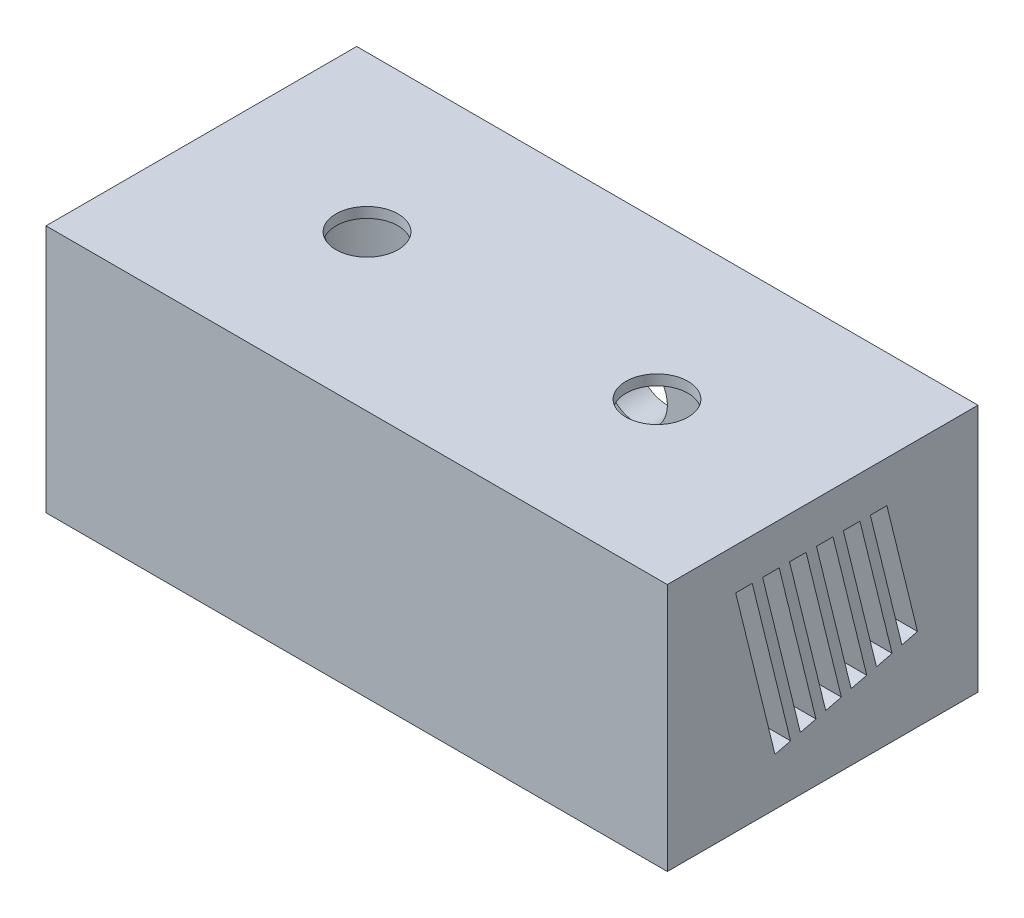
from build123d import *

# Parameters (mm, degrees)
SKETCH2_W                                     = 300
SKETCH2_H                                     = 150
BOSS_EXTRUDE1_DEPTH                           = 120
CUT_EXTRUDE2_DEPTH                            = 5
CUT_EXTRUDE3_DEPTH                            = 110
CBORE_FOR_M4_PAN_HEAD_MACHINE_SCREW1_AT_COUNT = 2
CBORE_FOR_M4_PAN_HEAD_MACHINE_SCREW1_AT_PITCH = 256
CBORE_FOR_M4_PAN_HEAD_MACHINE_SCREW1_2_COUNT  = 2
CBORE_FOR_M4_PAN_HEAD_MACHINE_SCREW1_2_PITCH  = 277.077606457
CBORE_FOR_M4_PAN_HEAD_MACHINE_SCREW1_3_COUNT  = 2
CBORE_FOR_M4_PAN_HEAD_MACHINE_SCREW1_3_PITCH  = 106
CUT_EXTRUDE5_DEPTH                            = 332.700165812
SKETCH17_R                                    = 15
CUT_EXTRUDE6_DEPTH                            = 20
SKETCH3_R                                     = 15
CUT_EXTRUDE1_DEPTH                            = 50


with BuildPart() as part:
    # Sketch2 → Boss-Extrude1 (new body)
    with BuildSketch(Plane(origin=(0, 0, 0), x_dir=(1, 0, 0), z_dir=(0, 1, 0))):
        Rectangle(SKETCH2_W, SKETCH2_H)
    extrude(amount=BOSS_EXTRUDE1_DEPTH)

    # Sketch7 → Cut-Extrude2 (cut)
    with BuildSketch(Plane.XZ):
        with BuildLine():
            Line((-120, 65), (120, 65))
            ThreePointArc((120, 65), (134.142135624, 59.142135624), (140, 45))
            Line((140, 45), (140, -45))
            ThreePointArc((140, -45), (134.142135624, -59.142135624), (120, -65))
            Line((120, -65), (-120, -65))
            ThreePointArc((-120, -65), (-134.142135624, -59.142135624), (-140, -45))
            Line((-140, -45), (-140, 45))
            ThreePointArc((-140, 45), (-134.142135624, 59.142135624), (-120, 65))
        make_face()
    extrude(amount=-CUT_EXTRUDE2_DEPTH, mode=Mode.SUBTRACT)

    # Sketch8 → Cut-Extrude3 (cut)
    with BuildSketch(Plane.XZ.offset(-5)):
        with BuildLine():
            Line((-91.715728753, 60), (91.715728753, 60))
            ThreePointArc((91.715728753, 60), (122.32233047, 47.32233047), (135, 16.715728753))
            Line((135, 16.715728753), (135, -16.715728753))
            ThreePointArc((135, -16.715728753), (122.32233047, -47.32233047), (91.715728753, -60))
            Line((91.715728753, -60), (-91.715728753, -60))
            ThreePointArc((-91.715728753, -60), (-122.32233047, -47.32233047), (-135, -16.715728753))
            Line((-135, -16.715728753), (-135, 16.715728753))
            ThreePointArc((-135, 16.715728753), (-122.32233047, 47.32233047), (-91.715728753, 60))
        make_face()
    extrude(amount=-CUT_EXTRUDE3_DEPTH, mode=Mode.SUBTRACT)

    # Sketch14 → CBORE for M4 Pan Head Machine Screw1 (revolve, cut)
    with BuildSketch(Plane(origin=(128, 0, -53), x_dir=(0, 0, -1), z_dir=(1, 0, 0))):
        Polygon((0, 0), (0, 31.351936393), (2.25, 30), (2.25, 3.1), (4.5, 3.1), (4.5, 0.025), (4.525, 0), align=None)
    cbore_for_m4_pan_head_machine_screw1 = revolve(axis=Axis((128, -6.35, -53), (0, 1, 0)), mode=Mode.SUBTRACT)

    # CBORE for M4 Pan Head Machine Screw1 at: CBORE for M4 Pan Head Machine Screw1 ×2
    with Locations(*[(-i * CBORE_FOR_M4_PAN_HEAD_MACHINE_SCREW1_AT_PITCH, 0, 0) for i in range(1, CBORE_FOR_M4_PAN_HEAD_MACHINE_SCREW1_AT_COUNT)]):
        add(cbore_for_m4_pan_head_machine_screw1, mode=Mode.SUBTRACT)

    # CBORE for M4 Pan Head Machine Screw1 2: CBORE for M4 Pan Head Machine Screw1 ×2
    with Locations(*[Vector(-0.9239288705910962, 0, 0.38256429797912606) * (i * CBORE_FOR_M4_PAN_HEAD_MACHINE_SCREW1_2_PITCH) for i in range(1, CBORE_FOR_M4_PAN_HEAD_MACHINE_SCREW1_2_COUNT)]):
        add(cbore_for_m4_pan_head_machine_screw1, mode=Mode.SUBTRACT)

    # CBORE for M4 Pan Head Machine Screw1 3: CBORE for M4 Pan Head Machine Screw1 ×2
    with Locations(*[(0, 0, i * CBORE_FOR_M4_PAN_HEAD_MACHINE_SCREW1_3_PITCH) for i in range(1, CBORE_FOR_M4_PAN_HEAD_MACHINE_SCREW1_3_COUNT)]):
        add(cbore_for_m4_pan_head_machine_screw1, mode=Mode.SUBTRACT)

    # Sketch15 → Cut-Extrude5 (cut, through all)
    with BuildSketch(Plane(origin=(150, 0, 0), x_dir=(0, 0, -1), z_dir=(1, 0, 0))):
        Polygon((-42, 100), (-23.029720743, 23.02020202), (-15.487735621, 24.878787879), (-34, 100), align=None)
        Polygon((-29, 100), (-10.773994919, 26.04040404), (-3.232009797, 27.898989899), (-21, 100), align=None)
        Polygon((-16, 100), (1.481730904, 29.060606061), (9.023716027, 30.919191919), (-8, 100), align=None)
        Polygon((-3, 100), (13.737456728, 32.080808081), (21.27944185, 33.939393939), (5, 100), align=None)
        Polygon((10, 100), (25.993182552, 35.101010101), (33.535167674, 36.95959596), (18, 100), align=None)
        Polygon((23, 100), (38.248908375, 38.121212121), (45.790893498, 39.97979798), (31, 100), align=None)
    extrude(amount=-CUT_EXTRUDE5_DEPTH, mode=Mode.SUBTRACT)

    # Sketch17 → Cut-Extrude6 (cut)
    with BuildSketch(Plane(origin=(0, 0, -75), x_dir=(-1, 0, 0), z_dir=(0, 0, -1))):
        with Locations((0, 60)):
            Circle(SKETCH17_R)
    extrude(amount=-CUT_EXTRUDE6_DEPTH, mode=Mode.SUBTRACT)

    # Sketch3 → Cut-Extrude1 (cut)
    with BuildSketch(Plane(origin=(0, 120, 0), x_dir=(1, 0, 0), z_dir=(0, 1, 0))):
        with Locations(Location((-70, 0, 0), (0, 0, 270))):
            Circle(SKETCH3_R)
        with Locations(Location((70, 0, 0), (0, 0, 270))):
            Circle(SKETCH3_R)
    extrude(amount=-CUT_EXTRUDE1_DEPTH, mode=Mode.SUBTRACT)


solid = part.part
